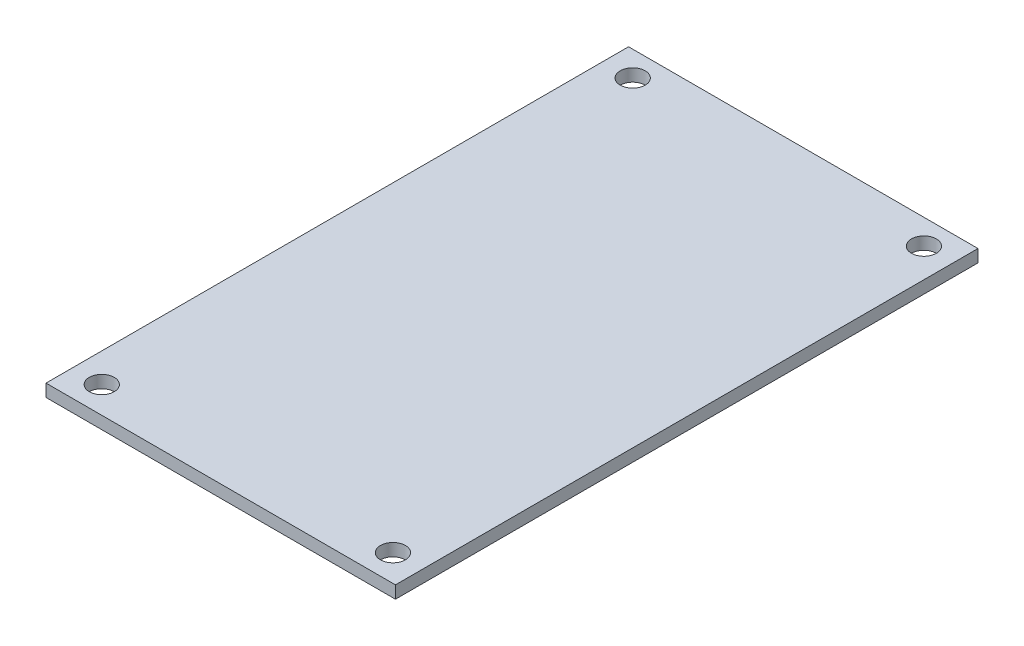
from build123d import *

# Parameters (mm, degrees)
SKETCH1_W           = 42
SKETCH1_H           = 70.015633911
SKETCH1_R           = 1.5
BOSS_EXTRUDE1_DEPTH = 1.5


with BuildPart() as part:
    # Sketch1 → Boss-Extrude1 (new body)
    with BuildSketch(Plane(origin=(0, 0, 0), x_dir=(1, 0, 0), z_dir=(0, 1, 0))):
        with Locations((21, 35.007816956)):
            Rectangle(SKETCH1_W, SKETCH1_H)
        with Locations(Location((3.5, 67.015633911, 0), (0, 0, 270))):
            Circle(SKETCH1_R, mode=Mode.SUBTRACT)
        with Locations(Location((38.5, 67.015633911, 0), (0, 0, 270))):
            Circle(SKETCH1_R, mode=Mode.SUBTRACT)
        with Locations(Location((3.5, 3.2, 0), (0, 0, 270))):
            Circle(SKETCH1_R, mode=Mode.SUBTRACT)
        with Locations(Location((38.5, 3.2, 0), (0, 0, 270))):
            Circle(SKETCH1_R, mode=Mode.SUBTRACT)
    extrude(amount=BOSS_EXTRUDE1_DEPTH)


solid = part.part
